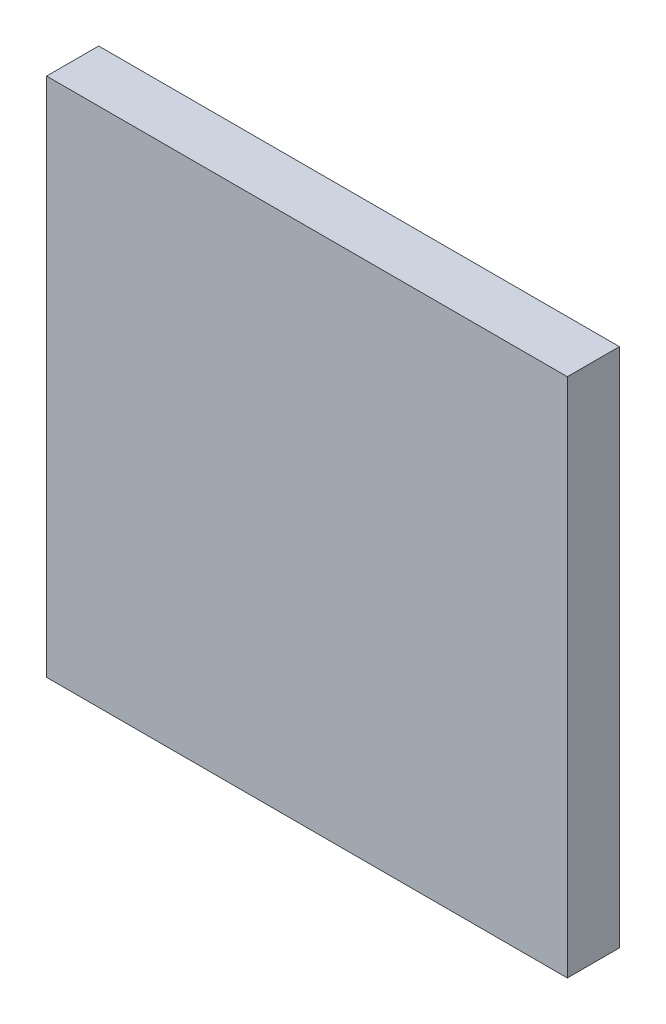
from build123d import *

# Parameters (mm, degrees)
SKETCH_1_W      = 200
SKETCH_1_H      = 200
EXTRUDE_1_DEPTH = 10


with BuildPart() as part:
    # 草图1 → 凸台-拉伸1 (new, symmetric)
    with BuildSketch(Plane.XY):
        Rectangle(SKETCH_1_W, SKETCH_1_H)
    extrude(amount=EXTRUDE_1_DEPTH, both=True)


solid = part.part
